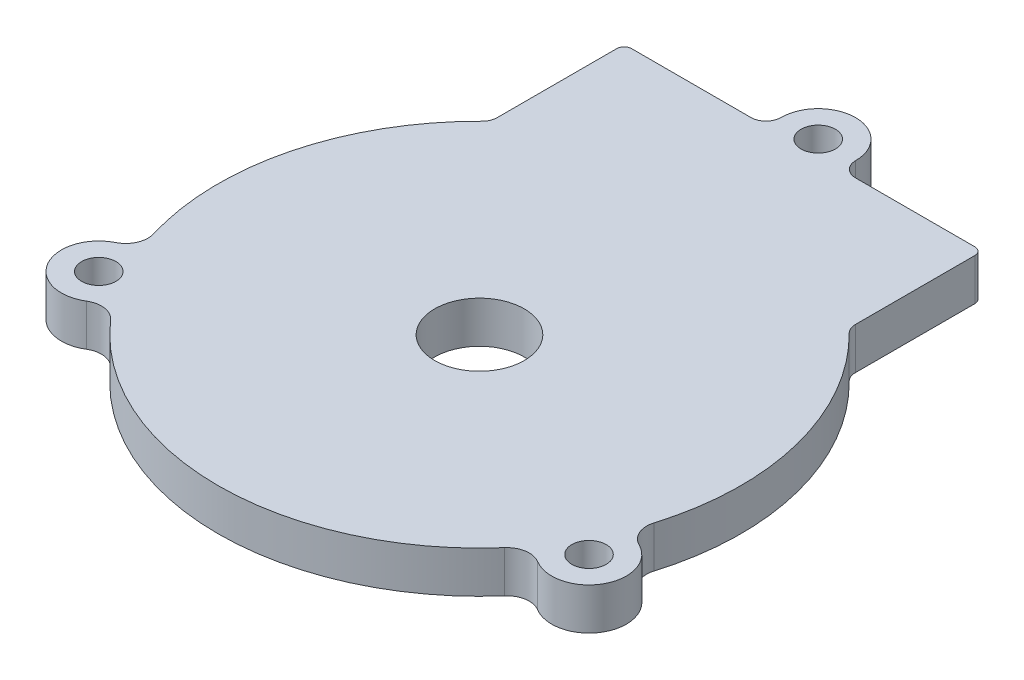
from build123d import *

# Parameters (mm, degrees)
SKETCH1_R                  = 35
SKETCH1_R_2                = 6
SKETCH1_R_3                = 5
SKETCH1_R_4                = 2.3
SKETCH1_W                  = 47.96
SKETCH1_H                  = 25
BOSS_EXTRUDE3_DEPTH        = 5.588
F_4_6_4_6_DIAMETER_HOLE1_D = 4.6
FILLET1_R                  = 3
FILLET2_R                  = 2
FILLET3_R                  = 2
FILLET4_R                  = 1


with BuildPart() as part:
    # Sketch1 → Boss-Extrude3 (new body)
    # profile 1 of 5: a face of its own
    with BuildSketch(Plane(origin=(0, 0, 0), x_dir=(1, 0, 0), z_dir=(0, 1, 0))):
        with Locations((32.785, 23.351471482)):
            Circle(SKETCH1_R)
        with Locations(Location((32.785, 23.351471482, 0), (0, 0, 270))):
            Circle(SKETCH1_R_2, mode=Mode.SUBTRACT)
    # profile 2 of 5: a face of its own
    with BuildSketch(Plane(origin=(0, 0, 0), x_dir=(1, 0, 0), z_dir=(0, 1, 0))):
        with Locations((65.600049901, 5.201471482)):
            Circle(SKETCH1_R_3)
        with Locations(Location((65.600049901, 5.201471482, 0), (0, 0, 270))):
            Circle(SKETCH1_R_4, mode=Mode.SUBTRACT)
    # profile 3 of 5: a face of its own
    with BuildSketch(Plane(origin=(0, 0, 0), x_dir=(1, 0, 0), z_dir=(0, 1, 0))):
        with Locations((-0.030049901, 5.201471482)):
            Circle(SKETCH1_R_3)
        with Locations(Location((-0.030049901, 5.201471482, 0), (0, 0, 270))):
            Circle(SKETCH1_R_4, mode=Mode.SUBTRACT)
    # profile 4 of 5: a face of its own
    with BuildSketch(Plane(origin=(0, 0, 0), x_dir=(1, 0, 0), z_dir=(0, 1, 0))):
        with Locations((32.785, 68.701471482)):
            Circle(SKETCH1_R_3)
    # profile 5 of 5: a face of its own
    with BuildSketch(Plane(origin=(0, 0, 0), x_dir=(1, 0, 0), z_dir=(0, 1, 0))):
        with Locations((32.785, 54.201471482)):
            Rectangle(SKETCH1_W, SKETCH1_H)
    extrude(amount=BOSS_EXTRUDE3_DEPTH)

    # Ø4.6 (4.6) Diameter Hole1 (through all)
    with Locations(Plane(origin=(0, 5.588, 0), x_dir=(1, 0, 0), z_dir=(0, 1, 0))):
        with Locations((32.785, 68.701471482)):
            Hole(F_4_6_4_6_DIAMETER_HOLE1_D / 2)

    # Fillet1
    fillet1_edges = [part.edges().sort_by_distance(p)[0] for p in [
        (65.214711372, 2.794, -10.18660079),
        (61.172514444, 2.794, -2.878342174),
        (0.355288628, 2.794, -10.18660079),
        (4.397485556, 2.794, -2.878342174),
    ]]
    fillet(fillet1_edges, radius=FILLET1_R)

    # Fillet2
    fillet2_edges = [part.edges().sort_by_distance(p)[0] for p in [
        (28.202424305, 2.794, -66.701471482),
        (37.367575695, 2.794, -66.701471482),
    ]]
    fillet(fillet2_edges, radius=FILLET2_R)

    # Fillet3
    fillet3_edges = [part.edges().sort_by_distance(p)[0] for p in [
        (8.805, 2.794, -48.845776728),
        (56.765, 2.794, -48.845776728),
    ]]
    fillet(fillet3_edges, radius=FILLET3_R)

    # Fillet4
    fillet4_edges = [part.edges().sort_by_distance(p)[0] for p in [
        (56.765, 2.794, -66.701471482),
        (8.805, 2.794, -66.701471482),
    ]]
    fillet(fillet4_edges, radius=FILLET4_R)


solid = part.part
